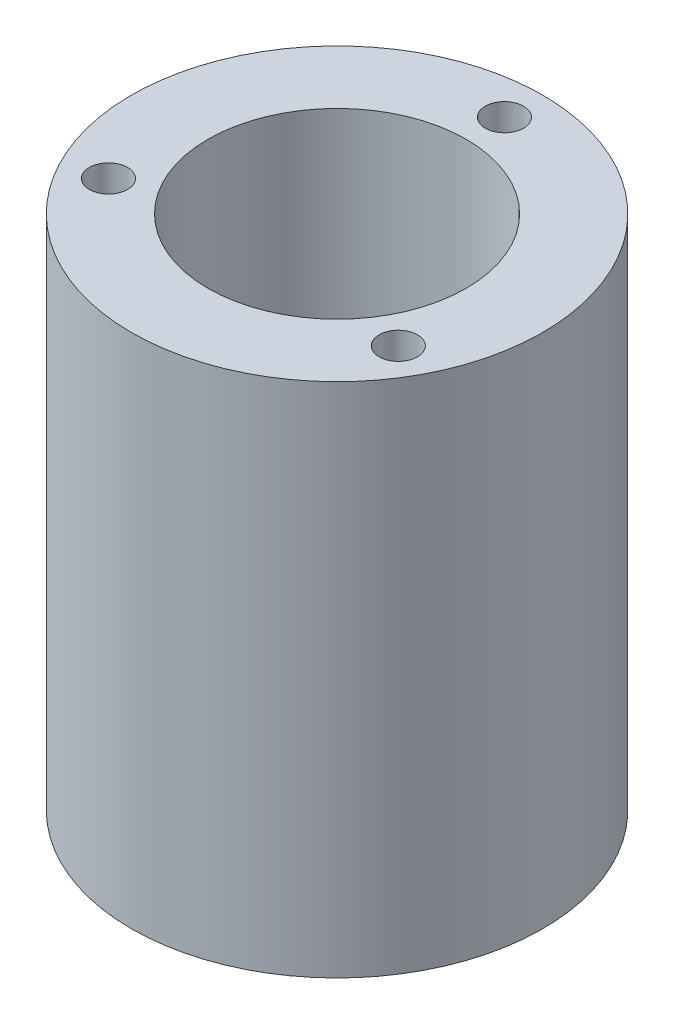
from build123d import *

# Parameters (mm, degrees)
SKETCH1_R           = 21.5
BOSS_EXTRUDE1_DEPTH = 4
SKETCH2_R           = 21.5
SKETCH2_R_2         = 13.5
BOSS_EXTRUDE2_DEPTH = 50
SKETCH3_R           = 2
CUT_EXTRUDE1_DEPTH  = 6
CIRPATTERN1_COUNT   = 3
CUT_EXTRUDE2_REACH  = 63.972
SKETCH4_W           = 3
SKETCH4_H           = 3


with BuildPart() as part:
    # Sketch1 → Boss-Extrude1 (new body)
    with BuildSketch(Plane(origin=(0, 0, 0), x_dir=(1, 0, 0), z_dir=(0, 1, 0))):
        with Locations(Location((0, 0, 0), (0, 0, 270))):
            Circle(SKETCH1_R)
    extrude(amount=BOSS_EXTRUDE1_DEPTH)

    # Sketch2 → Boss-Extrude2 (add)
    with BuildSketch(Plane(origin=(0, 4, 0), x_dir=(1, 0, 0), z_dir=(0, 1, 0))):
        with Locations(Location((0, 0, 0), (0, 0, 270))):
            Circle(SKETCH2_R)
        with Locations(Location((0, 0, 0), (0, 0, 270))):
            Circle(SKETCH2_R_2, mode=Mode.SUBTRACT)
    extrude(amount=BOSS_EXTRUDE2_DEPTH)

    # Sketch3 → Cut-Extrude1 (cut)
    with BuildSketch(Plane(origin=(0, 54, 0), x_dir=(1, 0, 0), z_dir=(0, 1, 0))):
        with Locations(Location((0, 17.5, 0), (0, 0, 270))):
            Circle(SKETCH3_R)
    cut_extrude1 = extrude(amount=-CUT_EXTRUDE1_DEPTH, mode=Mode.SUBTRACT)

    # CirPattern1: Cut-Extrude1 ×3 about axis
    cirpattern1_axis = Axis((0, 0, 0), (0, 1, 0))
    for i in range(1, CIRPATTERN1_COUNT):
        add(cut_extrude1.rotate(cirpattern1_axis, i * 360 / CIRPATTERN1_COUNT), mode=Mode.SUBTRACT)

    # Sketch4 → Cut-Extrude2 (cut, up to next)
    with BuildSketch(Plane.XZ, mode=Mode.PRIVATE) as cut_extrude2_sk1:
        Rectangle(SKETCH4_W, SKETCH4_H)
    cut_extrude2_tool1 = extrude(cut_extrude2_sk1.sketch, amount=-CUT_EXTRUDE2_REACH, mode=Mode.PRIVATE) & part.part
    add(cut_extrude2_tool1.solids().sort_by_distance((0, 0, 0))[0], mode=Mode.SUBTRACT)


solid = part.part
